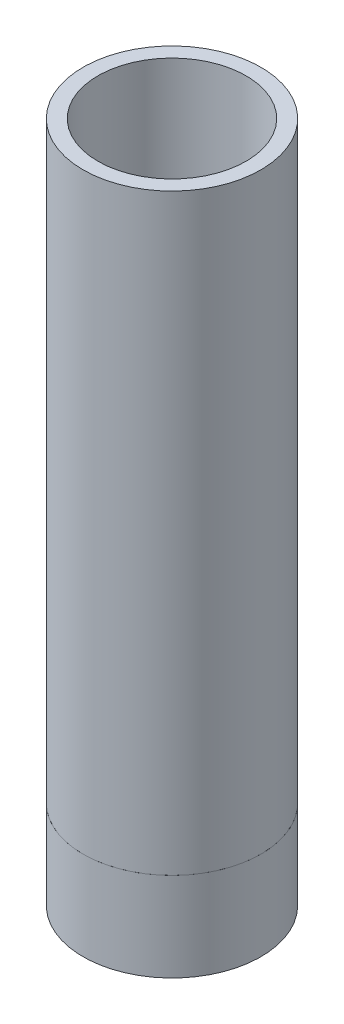
from build123d import *

# Parameters (mm, degrees)
SKETCH1_R           = 15
SKETCH1_R_2         = 12.5
BOSS_EXTRUDE1_DEPTH = 100
SKETCH2_R           = 12.5
BOSS_EXTRUDE2_DEPTH = 10
SKETCH3_R           = 15
SKETCH3_R_2         = 12.5
BOSS_EXTRUDE3_DEPTH = 15
CUT_EXTRUDE1_START  = -15
CUT_EXTRUDE1_DEPTH  = 15


with BuildPart() as part:
    # Sketch1 → Boss-Extrude1 (new body)
    with BuildSketch(Plane(origin=(0, 0, 0), x_dir=(1, 0, 0), z_dir=(0, 1, 0))):
        with Locations(Location((0, 0, 0), (0, 0, 270))):
            Circle(SKETCH1_R)
        with Locations(Location((0, 0, 0), (0, 0, 270))):
            Circle(SKETCH1_R_2, mode=Mode.SUBTRACT)
    extrude(amount=BOSS_EXTRUDE1_DEPTH)


with BuildPart() as body_2:
    # Sketch2 → Boss-Extrude2 (new body)
    with BuildSketch(Plane.XZ):
        with Locations(Location((0, 0, 0), (0, 0, 270))):
            Circle(SKETCH2_R)
    extrude(amount=-BOSS_EXTRUDE2_DEPTH)

    # Sketch5 → Cut-Extrude1 (cut)
    with BuildSketch(Plane(origin=(0, 10, 0), x_dir=(1, 0, 0), z_dir=(0, 1, 0)).offset(CUT_EXTRUDE1_START)):
        with BuildLine():
            ThreePointArc((12.362342011, -1.85), (12.465537998, -0.927557238), (12.5, 0))
            ThreePointArc((12.5, 0), (11.958147545, -1.308147545), (10.65, -1.85))
            Line((10.65, -1.85), (12.362342011, -1.85))
        make_face()
        with BuildLine():
            ThreePointArc((10.65, -1.85), (11.958147545, -1.308147545), (12.5, 0))
            Line((12.5, 0), (8.8, 0))
            ThreePointArc((8.8, 0), (9.341852455, -1.308147545), (10.65, -1.85))
        make_face()
        with BuildLine():
            Line((8.8, 0), (12.5, 0))
            ThreePointArc((12.5, 0), (12.049680443, 1.209708501), (10.917951723, 1.830492249))
            Line((10.917951723, 1.830492249), (10.65, 1.85))
            ThreePointArc((10.65, 1.85), (9.341852455, 1.308147545), (8.8, 0))
        make_face()
        with BuildLine():
            ThreePointArc((10.917951723, 1.830492249), (12.049680443, 1.209708501), (12.5, 0))
            ThreePointArc((12.5, 0), (12.470099392, 0.86407243), (12.380540614, 1.724011054))
            Line((12.380540614, 1.724011054), (10.917951723, 1.830492249))
        make_face()
    extrude(amount=CUT_EXTRUDE1_DEPTH, mode=Mode.SUBTRACT)


with BuildPart() as body_3:
    # Sketch3 → Boss-Extrude3 (new body)
    with BuildSketch(Plane.XZ):
        with Locations(Location((0, 0, 0), (0, 0, 270))):
            Circle(SKETCH3_R)
        with Locations(Location((0, 0, 0), (0, 0, 270))):
            Circle(SKETCH3_R_2, mode=Mode.SUBTRACT)
    extrude(amount=BOSS_EXTRUDE3_DEPTH)


solid = Compound([part.part, body_2.part, body_3.part])
